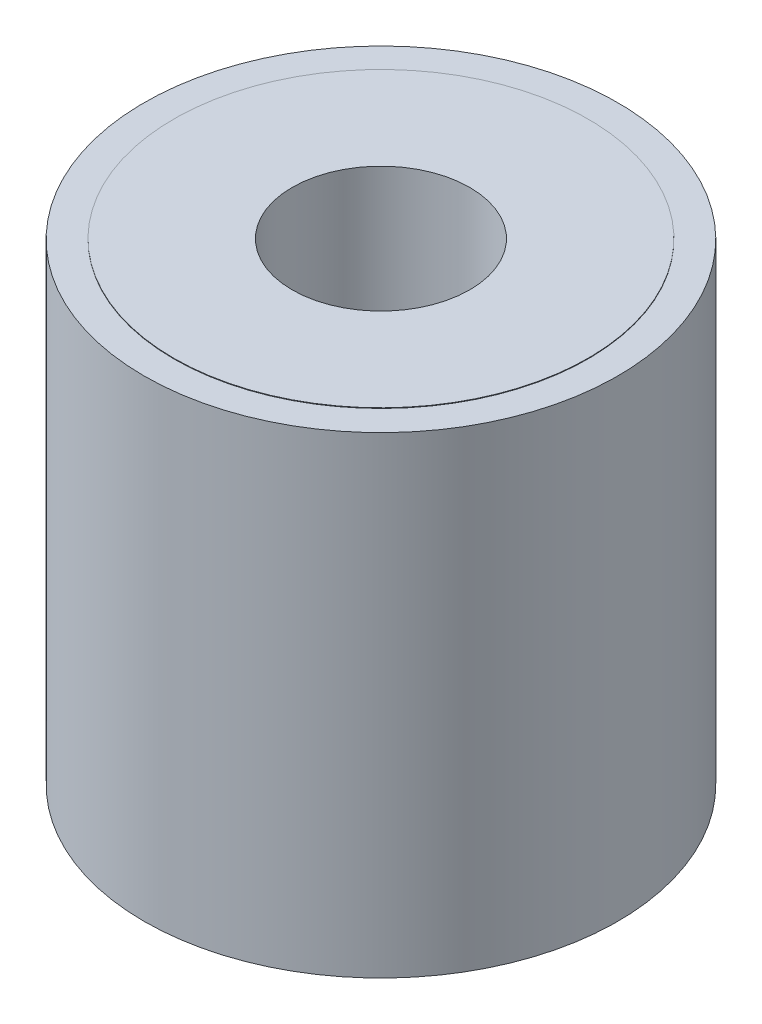
from build123d import *


with BuildPart() as part:
    # Sketch1 → Revolve1 (revolve)
    with BuildSketch(Plane.XY, mode=Mode.PRIVATE) as revolve1_sk:
        Polygon((0, -1), (-1.5, -1), (-1.5, -4), (-3.5, -4), (-3.5, -3.99), (-4, -3.99), (-4, 3.99), (-3.5, 3.99), (-3.5, 4), (-1.5, 4), (-1.5, 1), (0, 1), align=None)
    revolve(revolve1_sk.sketch.rotate(Axis((0, 1, 0), (0, -1, 0)), 270), axis=Axis((0, 1, 0), (0, -1, 0)))


solid = part.part
